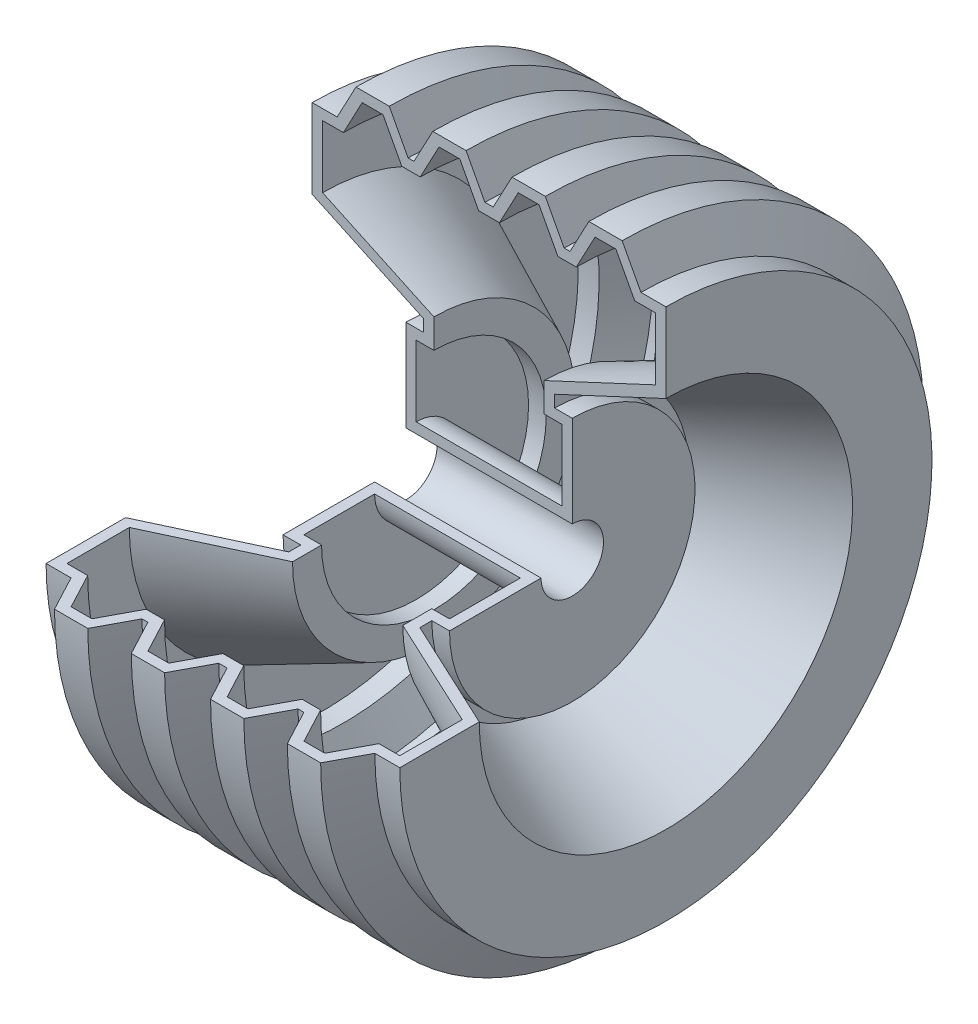
from build123d import *

# Parameters (mm, degrees)
REVOLVE_THIN1_ANGLE = 270


with BuildPart() as part:
    # Sketch1 → Revolve-Thin1 (revolve)
    with BuildSketch(Plane.XY):
        Polygon((-1.995696905, 127.895205728), (-11.034757243, 144.895205728), (-27.043363433, 144.895205728), (-36.082423772, 127.895205728), (-38.917576228, 127.895205728), (-47.956636567, 144.895205728), (-63.965242757, 144.895205728), (-73.004303095, 127.895205728), (-85, 127.895205728), (-85, 89.709854424), (-31.5, 64.762394712), (-31.5, 59), (-40, 59), (-40, 15), (40, 15), (40, 59), (31.5, 59), (31.5, 64.762394712), (85, 89.709854424), (85, 127.895205728), (73.004303095, 127.895205728), (63.965242757, 144.895205728), (47.956636567, 144.895205728), (38.917576228, 127.895205728), (36.082423772, 127.895205728), (27.043363433, 144.895205728), (11.034757243, 144.895205728), (1.995696905, 127.895205728), align=None)
        Polygon((-5, 122.895205728), (-14.039060338, 139.895205728), (-24.039060338, 139.895205728), (-33.078120676, 122.895205728), (-41.921879324, 122.895205728), (-50.960939662, 139.895205728), (-60.960939662, 139.895205728), (-70, 122.895205728), (-80, 122.895205728), (-80, 92.895205728), (-26.5, 67.947746016), (-26.5, 54), (-35, 54), (-35, 20), (35, 20), (35, 54), (26.5, 54), (26.5, 67.947746016), (80, 92.895205728), (80, 122.895205728), (70, 122.895205728), (60.960939662, 139.895205728), (50.960939662, 139.895205728), (41.921879324, 122.895205728), (33.078120676, 122.895205728), (24.039060338, 139.895205728), (14.039060338, 139.895205728), (5, 122.895205728), align=None, mode=Mode.SUBTRACT)
    revolve(axis=Axis((0, 0, 0), (-1, 0, 0)), revolution_arc=REVOLVE_THIN1_ANGLE)


solid = part.part
